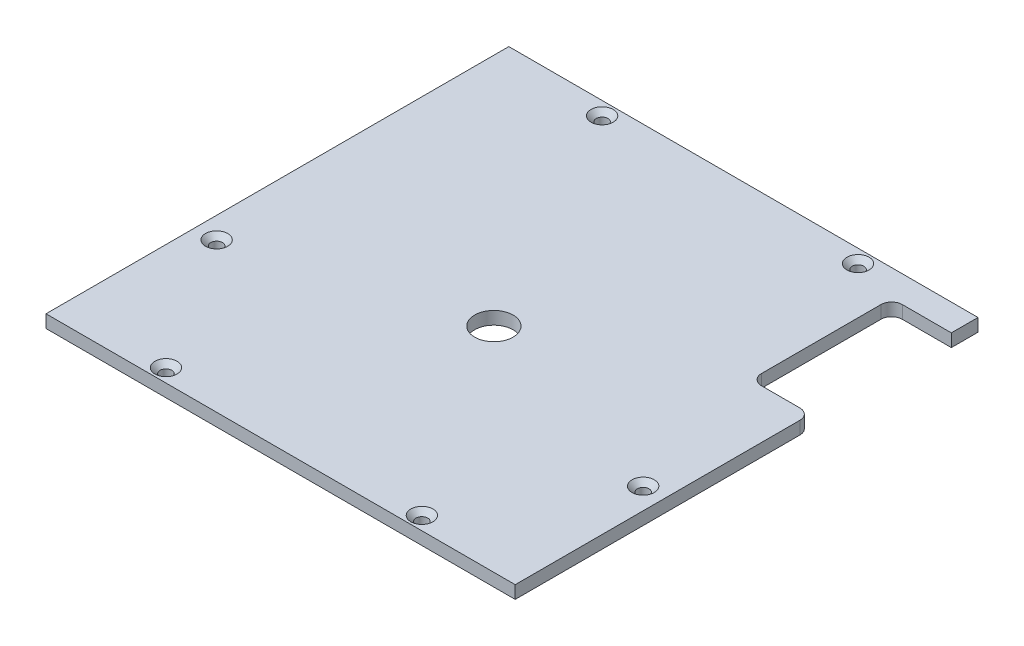
from build123d import *

# Parameters (mm, degrees)
SKETCH1_W                                = 220
SKETCH1_H                                = 217
BLOCO_DEPTH                              = 6
SKETCH2_R                                = 9
SKETCH2_W                                = 28
SKETCH2_H                                = 66
CORTE_MOTOR_DEPTH                        = 155.622928442
RAIOS_5MM_R                              = 5
FUROS_ESCAREADOS_M5_PASSANTE_D           = 5.5
FUROS_ESCAREADOS_M5_PASSANTE_CSINK_D     = 10.4
FUROS_ESCAREADOS_M5_PASSANTE_CSINK_ANGLE = 90


with BuildPart() as part:
    # Sketch1 → Bloco (new body)
    with BuildSketch(Plane(origin=(0, 0, 0), x_dir=(1, 0, 0), z_dir=(0, 1, 0))):
        Rectangle(SKETCH1_W, SKETCH1_H)
    extrude(amount=BLOCO_DEPTH)

    # Sketch2 → Corte Motor (cut, through all)
    with BuildSketch(Plane(origin=(0, 6, 0), x_dir=(1, 0, 0), z_dir=(0, 1, 0))):
        with Locations(Location((0, -8.5, 0), (0, 0, 270))):
            Circle(SKETCH2_R)
        with Locations((96, 63)):
            Rectangle(SKETCH2_W, SKETCH2_H)
    extrude(amount=-CORTE_MOTOR_DEPTH, mode=Mode.SUBTRACT)

    # Raios 5mm
    raios_5mm_edges = [part.edges().sort_by_distance(p)[0] for p in [
        (82, 3, -30),
        (82, 3, -96),
        (110, 3, -30),
    ]]
    fillet(raios_5mm_edges, radius=RAIOS_5MM_R)

    # Furos Escareados - M5 Passante (through all)
    with Locations(Plane(origin=(0, 6, 0), x_dir=(1, 0, 0), z_dir=(0, 1, 0))):
        with Locations((-100, -38.5), (-60, -102.25), (60, -102.25), (100, -38.5), (-60, 102.25), (60, 102.25)):
            CounterSinkHole(FUROS_ESCAREADOS_M5_PASSANTE_D / 2, FUROS_ESCAREADOS_M5_PASSANTE_CSINK_D / 2, counter_sink_angle=FUROS_ESCAREADOS_M5_PASSANTE_CSINK_ANGLE)


solid = part.part
